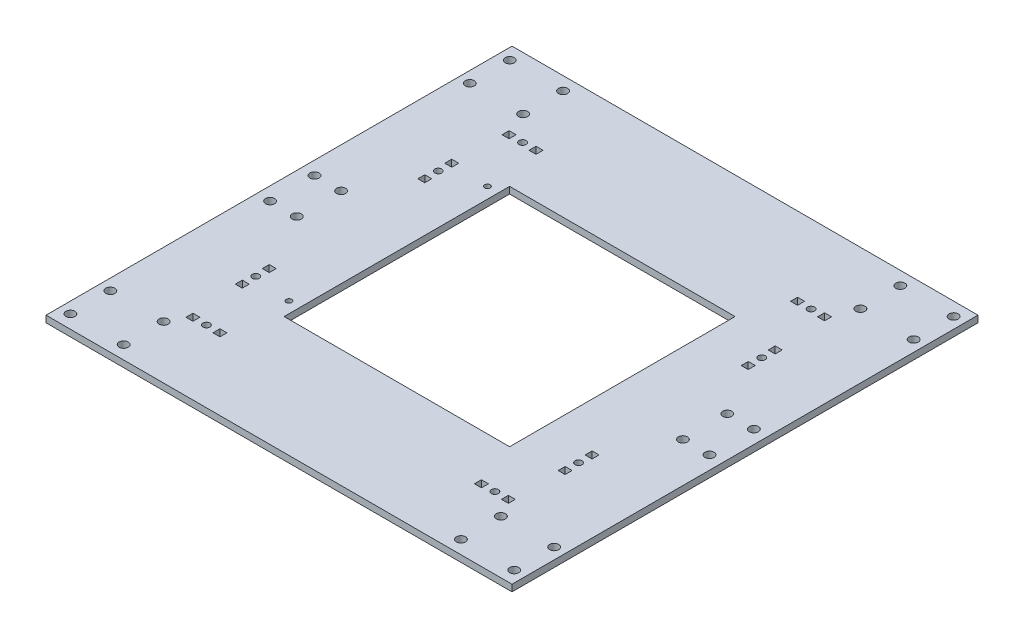
from build123d import *

# Parameters (mm, degrees)
SKETCH2_W           = 210
SKETCH2_H           = 210
SKETCH2_R           = 2.05
SKETCH2_R_2         = 1.575
SKETCH2_R_3         = 1.25
SKETCH2_W_2         = 101.6
SKETCH2_H_2         = 101.6
SKETCH2_W_3         = 3.15
SKETCH2_H_3         = 3.15
BOSS_EXTRUDE2_DEPTH = 3


with BuildPart() as part:
    # Sketch2 → Boss-Extrude2 (new body)
    with BuildSketch(Plane(origin=(0, 0, 0), x_dir=(1, 0, 0), z_dir=(0, 1, 0))):
        with Locations((105, 105)):
            Rectangle(SKETCH2_W, SKETCH2_H)
        with Locations(Location((5, 24, 0), (0, 0, 270))):
            Circle(SKETCH2_R, mode=Mode.SUBTRACT)
        with Locations(Location((29, 24, 0), (0, 0, 270))):
            Circle(SKETCH2_R, mode=Mode.SUBTRACT)
        with Locations(Location((40, 32.3, 0), (0, 0, 270))):
            Circle(SKETCH2_R_2, mode=Mode.SUBTRACT)
        with Locations(Location((205, 6, 0), (0, 0, 270))):
            Circle(SKETCH2_R, mode=Mode.SUBTRACT)
        with Locations(Location((181, 6, 0), (0, 0, 270))):
            Circle(SKETCH2_R, mode=Mode.SUBTRACT)
        with Locations(Location((170, 32.3, 0), (0, 0, 270))):
            Circle(SKETCH2_R_2, mode=Mode.SUBTRACT)
        with Locations(Location((29, 6, 0), (0, 0, 270))):
            Circle(SKETCH2_R, mode=Mode.SUBTRACT)
        with Locations(Location((5, 6, 0), (0, 0, 270))):
            Circle(SKETCH2_R, mode=Mode.SUBTRACT)
        with Locations(Location((181, 24, 0), (0, 0, 270))):
            Circle(SKETCH2_R, mode=Mode.SUBTRACT)
        with Locations(Location((205, 24, 0), (0, 0, 270))):
            Circle(SKETCH2_R, mode=Mode.SUBTRACT)
        with Locations(Location((205, 186, 0), (0, 0, 270))):
            Circle(SKETCH2_R, mode=Mode.SUBTRACT)
        with Locations(Location((181, 186, 0), (0, 0, 270))):
            Circle(SKETCH2_R, mode=Mode.SUBTRACT)
        with Locations(Location((40, 174.76, 0), (0, 0, 270))):
            Circle(SKETCH2_R_2, mode=Mode.SUBTRACT)
        with Locations(Location((181, 204, 0), (0, 0, 270))):
            Circle(SKETCH2_R, mode=Mode.SUBTRACT)
        with Locations(Location((205, 204, 0), (0, 0, 270))):
            Circle(SKETCH2_R, mode=Mode.SUBTRACT)
        with Locations(Location((5, 204, 0), (0, 0, 270))):
            Circle(SKETCH2_R, mode=Mode.SUBTRACT)
        with Locations(Location((29, 204, 0), (0, 0, 270))):
            Circle(SKETCH2_R, mode=Mode.SUBTRACT)
        with Locations(Location((170, 174.76, 0), (0, 0, 270))):
            Circle(SKETCH2_R_2, mode=Mode.SUBTRACT)
        with Locations(Location((29, 186, 0), (0, 0, 270))):
            Circle(SKETCH2_R, mode=Mode.SUBTRACT)
        with Locations(Location((5, 186, 0), (0, 0, 270))):
            Circle(SKETCH2_R, mode=Mode.SUBTRACT)
        with Locations(Location((177.6, 62.41, 0), (0, 0, 270))):
            Circle(SKETCH2_R_2, mode=Mode.SUBTRACT)
        with Locations(Location((177.88, 144.65, 0), (0, 0, 270))):
            Circle(SKETCH2_R_2, mode=Mode.SUBTRACT)
        with Locations(Location((32.12, 144.65, 0), (0, 0, 270))):
            Circle(SKETCH2_R_2, mode=Mode.SUBTRACT)
        with Locations(Location((32.12, 62.41, 0), (0, 0, 270))):
            Circle(SKETCH2_R_2, mode=Mode.SUBTRACT)
        with Locations(Location((49.2, 149.719, 0), (0, 0, 270))):
            Circle(SKETCH2_R_3, mode=Mode.SUBTRACT)
        with Locations(Location((49.2, 60.281, 0), (0, 0, 270))):
            Circle(SKETCH2_R_3, mode=Mode.SUBTRACT)
        with Locations(Location((18.000065795, 95, 0), (0, 0, 270))):
            Circle(SKETCH2_R, mode=Mode.SUBTRACT)
        with Locations(Location((18, 115, 0), (0, 0, 270))):
            Circle(SKETCH2_R, mode=Mode.SUBTRACT)
        with Locations(Location((6, 115.000053284, 0), (0, 0, 270))):
            Circle(SKETCH2_R, mode=Mode.SUBTRACT)
        with Locations(Location((6, 95, 0), (0, 0, 270))):
            Circle(SKETCH2_R, mode=Mode.SUBTRACT)
        with Locations(Location((204, 95, 0), (0, 0, 270))):
            Circle(SKETCH2_R, mode=Mode.SUBTRACT)
        with Locations(Location((204, 115.000053284, 0), (0, 0, 270))):
            Circle(SKETCH2_R, mode=Mode.SUBTRACT)
        with Locations(Location((191.999934205, 95, 0), (0, 0, 270))):
            Circle(SKETCH2_R, mode=Mode.SUBTRACT)
        with Locations(Location((192, 115, 0), (0, 0, 270))):
            Circle(SKETCH2_R, mode=Mode.SUBTRACT)
        with Locations((105, 103.919)):
            Rectangle(SKETCH2_W_2, SKETCH2_H_2, mode=Mode.SUBTRACT)
        with Locations((32.12, 150.725)):
            Rectangle(SKETCH2_W_3, SKETCH2_H_3, mode=Mode.SUBTRACT)
        with Locations((32.12, 138.575)):
            Rectangle(SKETCH2_W_3, SKETCH2_H_3, mode=Mode.SUBTRACT)
        with Locations((32.12, 68.485)):
            Rectangle(SKETCH2_W_3, SKETCH2_H_3, mode=Mode.SUBTRACT)
        with Locations((32.12, 56.335)):
            Rectangle(SKETCH2_W_3, SKETCH2_H_3, mode=Mode.SUBTRACT)
        with Locations((177.6, 68.485)):
            Rectangle(SKETCH2_W_3, SKETCH2_H_3, mode=Mode.SUBTRACT)
        with Locations((177.6, 56.335)):
            Rectangle(SKETCH2_W_3, SKETCH2_H_3, mode=Mode.SUBTRACT)
        with Locations((177.88, 138.575)):
            Rectangle(SKETCH2_W_3, SKETCH2_H_3, mode=Mode.SUBTRACT)
        with Locations((177.88, 150.725)):
            Rectangle(SKETCH2_W_3, SKETCH2_H_3, mode=Mode.SUBTRACT)
        with Locations((33.925, 32.3)):
            Rectangle(SKETCH2_W_3, SKETCH2_H_3, mode=Mode.SUBTRACT)
        with Locations((46.075, 32.3)):
            Rectangle(SKETCH2_W_3, SKETCH2_H_3, mode=Mode.SUBTRACT)
        with Locations((33.925, 174.76)):
            Rectangle(SKETCH2_W_3, SKETCH2_H_3, mode=Mode.SUBTRACT)
        with Locations((46.075, 174.76)):
            Rectangle(SKETCH2_W_3, SKETCH2_H_3, mode=Mode.SUBTRACT)
        with Locations((176.075, 32.3)):
            Rectangle(SKETCH2_W_3, SKETCH2_H_3, mode=Mode.SUBTRACT)
        with Locations((163.925, 32.3)):
            Rectangle(SKETCH2_W_3, SKETCH2_H_3, mode=Mode.SUBTRACT)
        with Locations((163.925, 174.76)):
            Rectangle(SKETCH2_W_3, SKETCH2_H_3, mode=Mode.SUBTRACT)
        with Locations((176.075, 174.76)):
            Rectangle(SKETCH2_W_3, SKETCH2_H_3, mode=Mode.SUBTRACT)
    extrude(amount=-BOSS_EXTRUDE2_DEPTH)


solid = part.part
